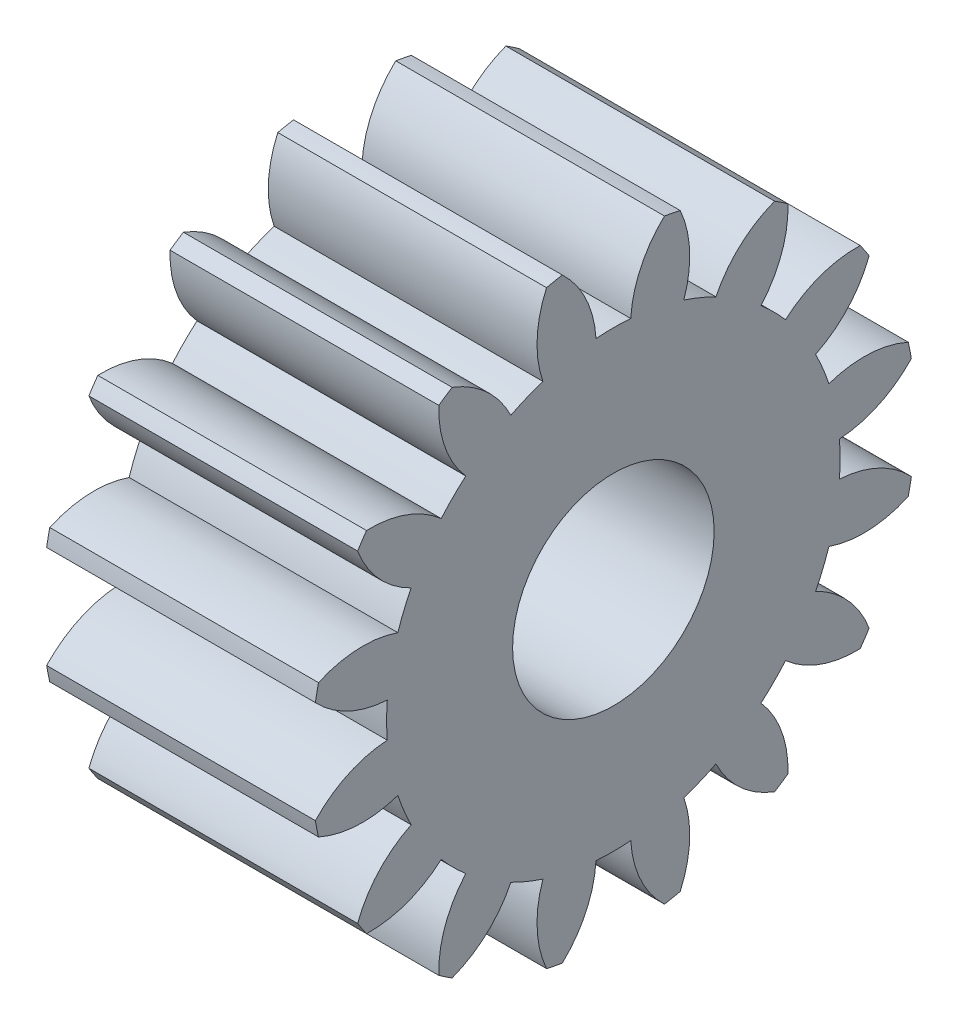
from build123d import *

# Parameters (mm, degrees)
BASPROSKE_W     = 40
BASPROSKE_H     = 45
TOOTHCUT_DEPTH  = 76.166481892
TEETHCUTS_COUNT = 16
TEETHCUTS_ANGLE = 337.5
BORSKE_R        = 15
BORE_DEPTH      = 50.0000508


with BuildPart() as part:
    # BasProSke → Base-Revolve (revolve)
    with BuildSketch(Plane(origin=(0, 0, 0), x_dir=(1, 0, 0), z_dir=(0, 1, 0)), mode=Mode.PRIVATE) as base_revolve_sk:
        with Locations((20, 22.5)):
            Rectangle(BASPROSKE_W, BASPROSKE_H)
    revolve(base_revolve_sk.sketch.rotate(Axis((-10, 0, 0), (1, 0, 0)), 180), axis=Axis((-10, 0, 0), (1, 0, 0)))

    # TooCutSke → ToothCut (cut, through all)
    with BuildSketch(Plane(origin=(0, 0, 0), x_dir=(0, 0, -1), z_dir=(1, 0, 0))):
        with BuildLine():
            ThreePointArc((2.585211293, 33.64983928), (0, 33.749), (-2.585211293, 33.64983928))
            ThreePointArc((-2.585211293, 33.64983928), (-4.077113604, 39.496303475), (-7.62816215, 44.37451732))
            ThreePointArc((-7.62816215, 44.37451732), (0, 45.0254), (7.62816215, 44.37451732))
            ThreePointArc((7.62816215, 44.37451732), (4.077113604, 39.496303475), (2.585211293, 33.64983928))
        make_face()
    toothcut = extrude(amount=TOOTHCUT_DEPTH, mode=Mode.SUBTRACT)

    # TeethCuts: ToothCut ×16 about axis
    teethcuts_axis = Axis((-10, 0, 0), (1, 0, 0))
    for i in range(1, TEETHCUTS_COUNT):
        add(toothcut.rotate(teethcuts_axis, i * TEETHCUTS_ANGLE / (TEETHCUTS_COUNT - 1)), mode=Mode.SUBTRACT)

    # BorSke → Bore (cut, symmetric)
    with BuildSketch(Plane(origin=(0, 0, 0), x_dir=(0, 0, -1), z_dir=(1, 0, 0))):
        with Locations(Location((0, 0, 0), (0, 0, 180))):
            Circle(BORSKE_R)
    extrude(amount=BORE_DEPTH, both=True, mode=Mode.SUBTRACT)


solid = part.part
